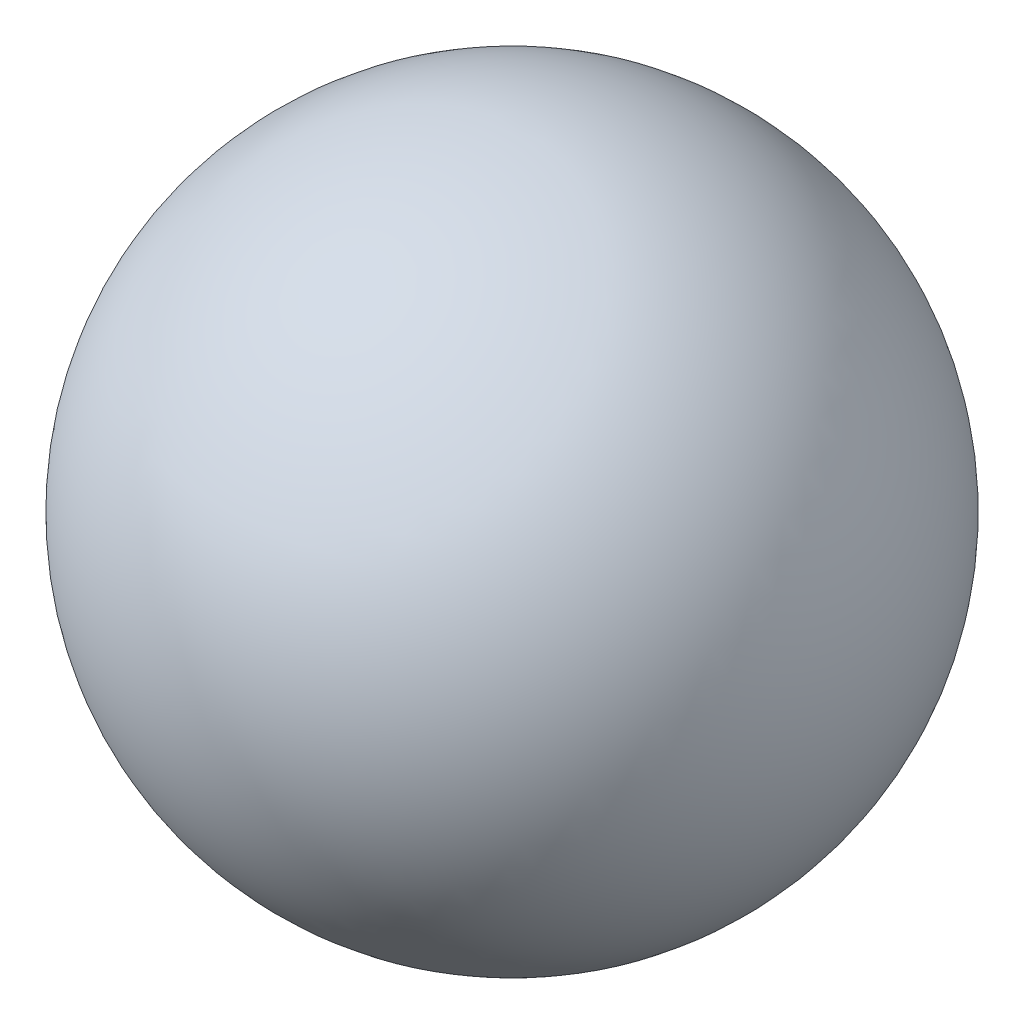
from build123d import *


with BuildPart() as part:
    # 草圖1 → 迴轉1 (revolve)
    with BuildSketch(Plane.XY):
        with BuildLine():
            Line((0, 0), (0, 30))
            ThreePointArc((0, 30), (30, 0), (0, -30))
            Line((0, -30), (0, 0))
        make_face()
    revolve(axis=Axis((0, 0, 0), (0, -1, 0)))


solid = part.part
